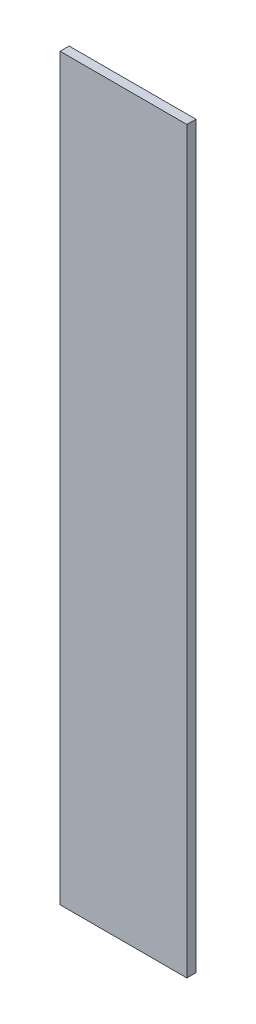
from build123d import *

# Parameters (mm, degrees)
SKETCH2_W           = 518.16
SKETCH2_H           = 88.9
BOSS_EXTRUDE1_DEPTH = 6.35


with BuildPart() as part:
    # Sketch2 → Boss-Extrude1 (new body)
    with BuildSketch(Plane(origin=(0, 0, 0), x_dir=(0, 1, 0), z_dir=(0, 0, 1))):
        with Locations((259.08, 44.45)):
            Rectangle(SKETCH2_W, SKETCH2_H)
    extrude(amount=BOSS_EXTRUDE1_DEPTH)


solid = part.part
